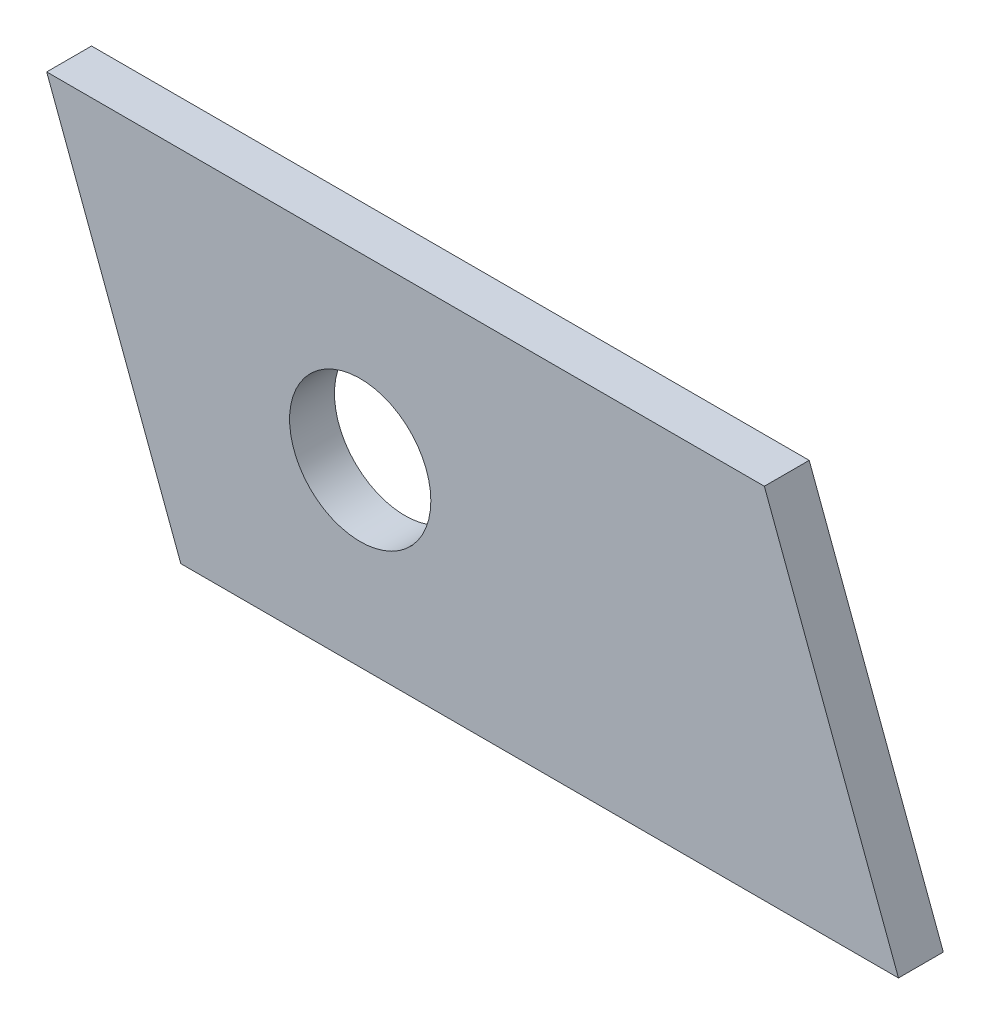
from build123d import *

# Parameters (mm, degrees)
SKETCH1_R           = 5
BOSS_EXTRUDE1_DEPTH = 3.175


with BuildPart() as part:
    # Sketch1 → Boss-Extrude1 (new body)
    with BuildSketch(Plane.XY):
        Polygon((-218.706905039, 117.173081747), (-209.213549558, 91.773081747), (-158.413549558, 91.773081747), (-167.906905039, 117.173081747), align=None)
        with Locations((-196.513549558, 104.473081747)):
            Circle(SKETCH1_R, mode=Mode.SUBTRACT)
    extrude(amount=-BOSS_EXTRUDE1_DEPTH)


solid = part.part
